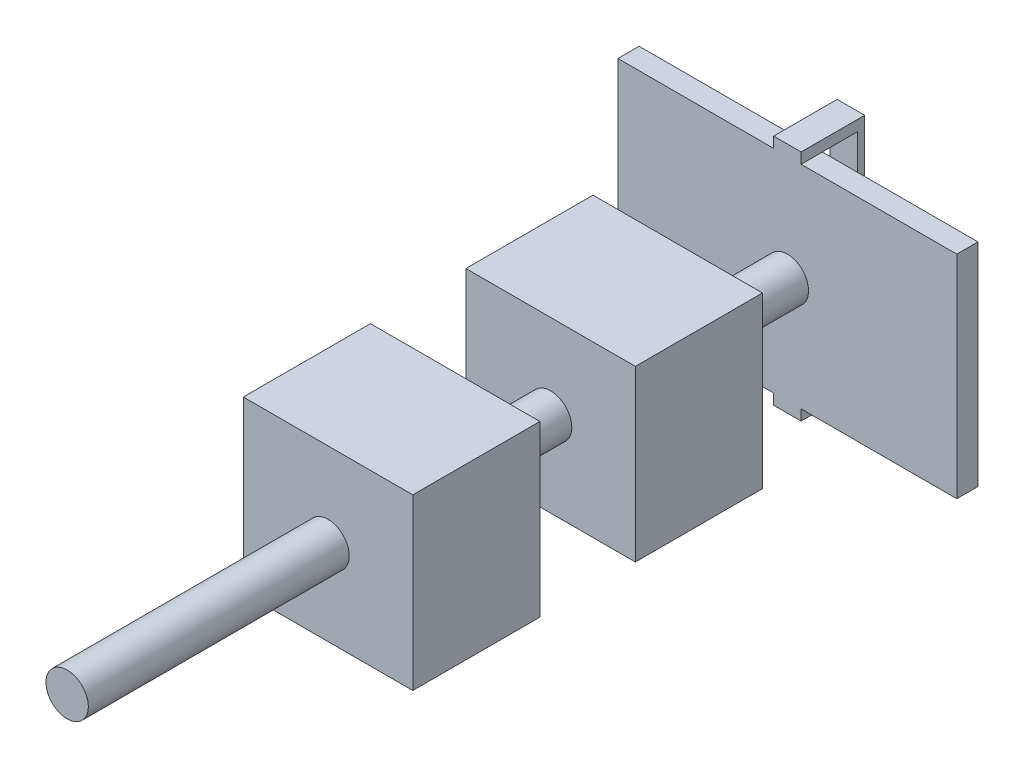
from build123d import *

# Parameters (mm, degrees)
SKETCH1_R                = 5
BOSS_EXTRUDE1_DEPTH      = 170
BOSS_EXTRUDE2_DEPTH      = 20
BOSS_EXTRUDE2_DEPTH_BACK = 20
SKETCH2_W                = 40
SKETCH2_H                = 30
SKETCH3_W                = 35.762712216
SKETCH3_H                = 36.50555787
CUT_EXTRUDE5_DEPTH       = 16
SKETCH5_R                = 5
BOSS_EXTRUDE3_DEPTH      = 16
SKETCH8_W                = 35.762712216
SKETCH8_H                = 36.50555787
CUT_EXTRUDE7_DEPTH       = 18
SKETCH10_R               = 5
BOSS_EXTRUDE4_DEPTH      = 18
SKETCH11_W               = 80
SKETCH11_H               = 50
BOSS_EXTRUDE5_DEPTH      = 5
BOSS_EXTRUDE6_REACH      = 192.919
SKETCH13_W               = 6.494593436
SKETCH13_H               = 55.023638824
SKETCH16_W               = 8.344392414
SKETCH16_H               = 50
CUT_EXTRUDE9_DEPTH       = 10
SKETCH17_W               = 3.25
SKETCH17_H               = 8.3
CUT_EXTRUDE10_DEPTH      = 10


with BuildPart() as part:
    # Sketch1 → Boss-Extrude1 (new body)
    with BuildSketch(Plane.XY):
        Circle(SKETCH1_R)
    extrude(amount=-BOSS_EXTRUDE1_DEPTH)

    # Sketch2 → Boss-Extrude2 (add, two sides: drawn at the far end of the back side and taken through both)
    with BuildSketch(Plane(origin=(0, 0, 0), x_dir=(1, 0, 0), z_dir=(0, 1, 0)).offset(-BOSS_EXTRUDE2_DEPTH_BACK)):
        with Locations((0, 76.591812116)):
            Rectangle(SKETCH2_W, SKETCH2_H)
        with Locations((0, 129.121611958)):
            Rectangle(SKETCH2_W, SKETCH2_H)
    extrude(amount=BOSS_EXTRUDE2_DEPTH + BOSS_EXTRUDE2_DEPTH_BACK)

    # Sketch3 → Cut-Extrude5 (cut)
    with BuildSketch(Plane(origin=(0, 0, -144.121611958), x_dir=(-1, 0, 0), z_dir=(0, 0, -1))):
        Rectangle(SKETCH3_W, SKETCH3_H)
    extrude(amount=-CUT_EXTRUDE5_DEPTH, mode=Mode.SUBTRACT)


with BuildPart() as cut_extrude5_piece_1:
    # of the separate pieces the step leaves, piece 1, a body of its own (cut_extrude5_pieces)
    add(part.part.solids().sort_by_distance((5, 0, 0))[0])



with BuildPart() as cut_extrude5_piece_2:
    # of the separate pieces the step leaves, piece 2, a body of its own (cut_extrude5_pieces)
    add(part.part.solids().sort_by_distance((5, 0, -144.121611958))[0])


with BuildPart() as cut_extrude5_piece_1_1:
    add(cut_extrude5_piece_1.part)

    add(cut_extrude5_piece_2.part)  # Boss-Extrude3 merges Cut-Extrude5 piece 2
    # Sketch5 → Boss-Extrude3 (add)
    with BuildSketch(Plane(origin=(0, 0, -128.121611958), x_dir=(-1, 0, 0), z_dir=(0, 0, -1))):
        with Locations(Location((0, 0, 0), (0, 0, 180))):
            Circle(SKETCH5_R)
    extrude(amount=BOSS_EXTRUDE3_DEPTH)

    # Sketch8 → Cut-Extrude7 (cut)
    with BuildSketch(Plane(origin=(0, 0, -91.591812116), x_dir=(-1, 0, 0), z_dir=(0, 0, -1))):
        Rectangle(SKETCH8_W, SKETCH8_H)
    extrude(amount=-CUT_EXTRUDE7_DEPTH, mode=Mode.SUBTRACT)


with BuildPart() as cut_extrude7_piece_1:
    # of the separate pieces the step leaves, piece 1, a body of its own (cut_extrude7_pieces)
    add(cut_extrude5_piece_1_1.part.solids().sort_by_distance((5, 0, -144.121611958))[0])



with BuildPart() as cut_extrude7_piece_2:
    # of the separate pieces the step leaves, piece 2, a body of its own (cut_extrude7_pieces)
    add(cut_extrude5_piece_1_1.part.solids().sort_by_distance((-20, 20, -91.591812116))[0])


with BuildPart() as cut_extrude7_piece_1_1:
    add(cut_extrude7_piece_1.part)

    add(cut_extrude7_piece_2.part)  # Boss-Extrude4 merges Cut-Extrude7 piece 2
    # Sketch10 → Boss-Extrude4 (add)
    with BuildSketch(Plane(origin=(0, 0, -73.591812116), x_dir=(-1, 0, 0), z_dir=(0, 0, -1))):
        with Locations(Location((0, 0, 0), (0, 0, 180))):
            Circle(SKETCH10_R)
    extrude(amount=BOSS_EXTRUDE4_DEPTH)

    # Sketch11 → Boss-Extrude5 (add)
    with BuildSketch(Plane(origin=(0, 0, -170), x_dir=(-1, 0, 0), z_dir=(0, 0, -1))):
        Rectangle(SKETCH11_W, SKETCH11_H)
    extrude(amount=BOSS_EXTRUDE5_DEPTH)

    # Boss-Extrude6: up to this face of the body (flat: up to its plane)
    boss_extrude6_end = Plane(cut_extrude7_piece_1_1.part.faces().sort_by_distance((0, -24.056601887, -170))[0])
    # Sketch13 → Boss-Extrude6 (add, up to the picked face)
    with BuildSketch(Plane(origin=(0, 0, -185), x_dir=(-1, 0, 0), z_dir=(0, 0, -1)), mode=Mode.PRIVATE) as boss_extrude6_sk1:
        Rectangle(SKETCH13_W, SKETCH13_H)
    boss_extrude6_tool1 = split(extrude(boss_extrude6_sk1.sketch, amount=-BOSS_EXTRUDE6_REACH, mode=Mode.PRIVATE), bisect_by=boss_extrude6_end, keep=Keep.BOTH, mode=Mode.PRIVATE)
    add(boss_extrude6_tool1.solids().sort_by(Axis((0, 0, -185), (0, 0, 1)))[0])

    # Sketch16 → Cut-Extrude9 (cut)
    with BuildSketch(Plane(origin=(3.247296718, 0, 0), x_dir=(0, 0, -1), z_dir=(1, 0, 0))):
        with Locations((179.172196207, 0)):
            Rectangle(SKETCH16_W, SKETCH16_H)
    extrude(amount=-CUT_EXTRUDE9_DEPTH, mode=Mode.SUBTRACT)

    # Sketch17 → Cut-Extrude10 (cut)
    with BuildSketch(Plane(origin=(0, 0, -185), x_dir=(-1, 0, 0), z_dir=(0, 0, -1))):
        Rectangle(SKETCH17_W, SKETCH17_H)
    extrude(amount=-CUT_EXTRUDE10_DEPTH, mode=Mode.SUBTRACT)


solid = cut_extrude7_piece_1_1.part
